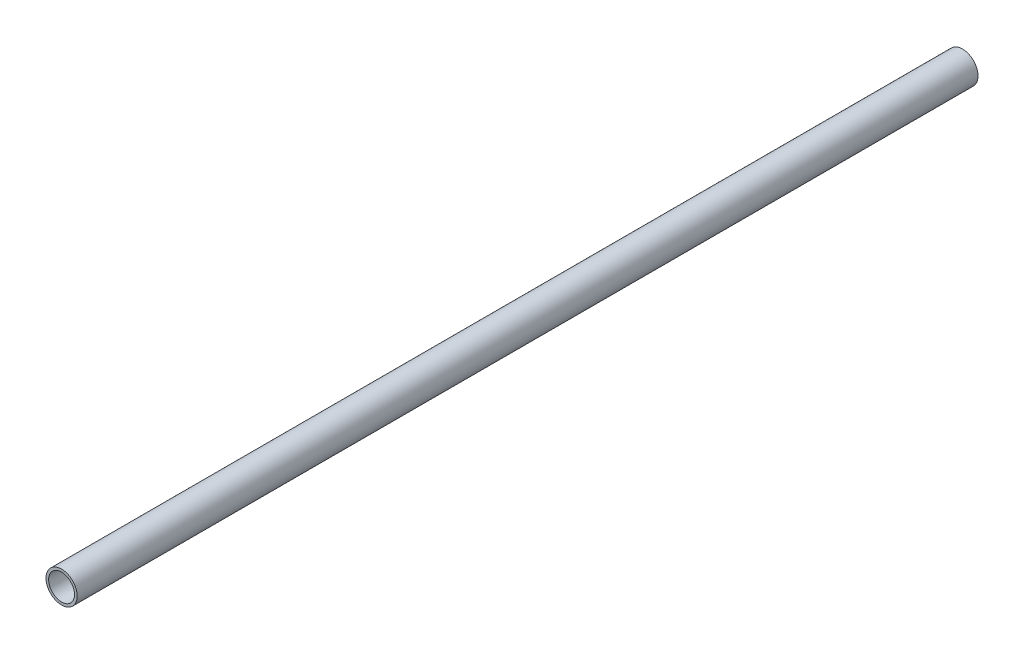
from build123d import *

# Parameters (mm, degrees)
SKETCH1_R           = 21.082
SKETCH1_R_2         = 17.526
BOSS_EXTRUDE1_DEPTH = 1219.2


with BuildPart() as part:
    # Sketch1 → Boss-Extrude1 (new body)
    with BuildSketch(Plane.XY):
        with Locations(Location((0, 0, 0), (0, 0, 180))):
            Circle(SKETCH1_R)
        with Locations(Location((0, 0, 0), (0, 0, 180))):
            Circle(SKETCH1_R_2, mode=Mode.SUBTRACT)
    extrude(amount=BOSS_EXTRUDE1_DEPTH)


solid = part.part
